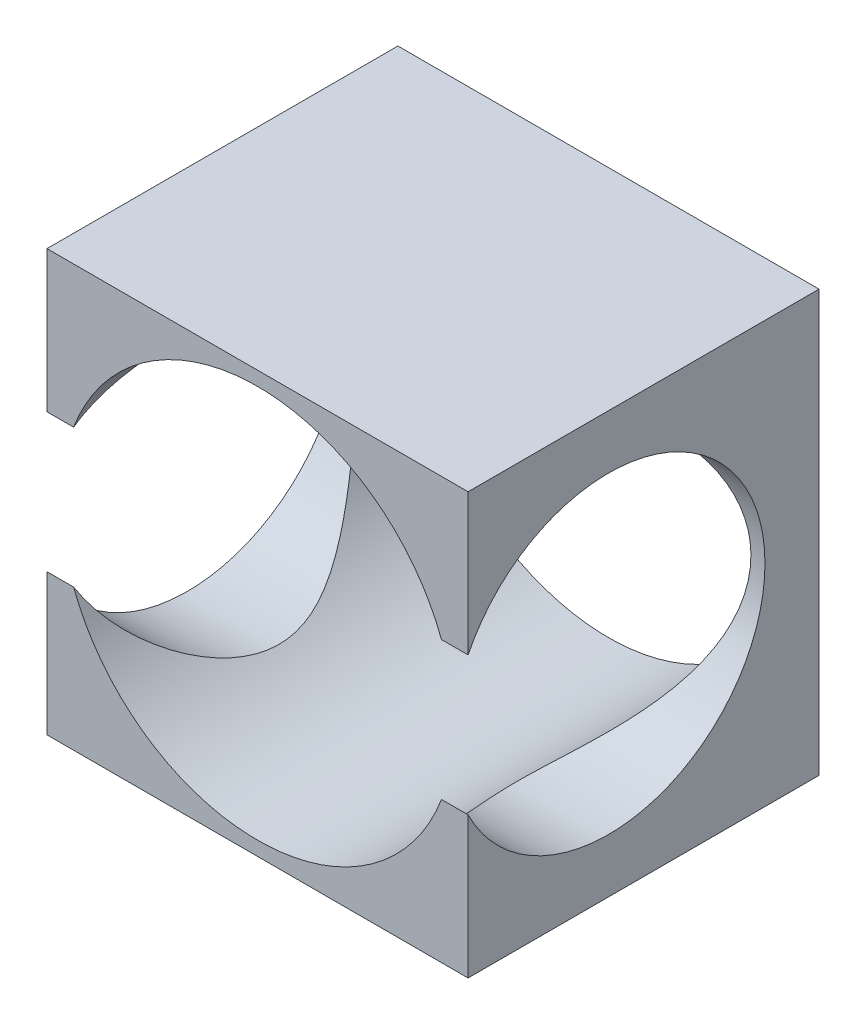
from build123d import *

# Parameters (mm, degrees)
SKETCH_1_W          = 30
SKETCH_1_H          = 30
SKETCH_1_R          = 14
EXTRUDE_1_DEPTH     = 25
SKETCH_2_R          = 11.15
CUT_EXTRUDE_1_DEPTH = 42.833001327
SKETCH_3_R          = 1.363368529
CUT_EXTRUDE_2_DEPTH = 5


with BuildPart() as part:
    # 草图1 → 凸台-拉伸1 (new body)
    with BuildSketch(Plane.XY):
        Rectangle(SKETCH_1_W, SKETCH_1_H)
        Circle(SKETCH_1_R, mode=Mode.SUBTRACT)
    extrude(amount=EXTRUDE_1_DEPTH)

    # 草图2 → 切除-拉伸1 (cut, through all)
    with BuildSketch(Plane.ZY.offset(15)):
        with Locations((15, 0)):
            Circle(SKETCH_2_R)
    extrude(amount=-CUT_EXTRUDE_1_DEPTH, mode=Mode.SUBTRACT)

    # 草图3 → 切除-拉伸2 (cut)
    with BuildSketch(Plane(origin=(0, 0, 0), x_dir=(-1, 0, 0), z_dir=(0, 0, -1))):
        with Locations((12, 12)):
            Circle(SKETCH_3_R)
        with Locations((12, -12)):
            Circle(SKETCH_3_R)
        with Locations((-12, -12)):
            Circle(SKETCH_3_R)
        with Locations((-12, 12)):
            Circle(SKETCH_3_R)
    extrude(amount=-CUT_EXTRUDE_2_DEPTH, mode=Mode.SUBTRACT)


solid = part.part
